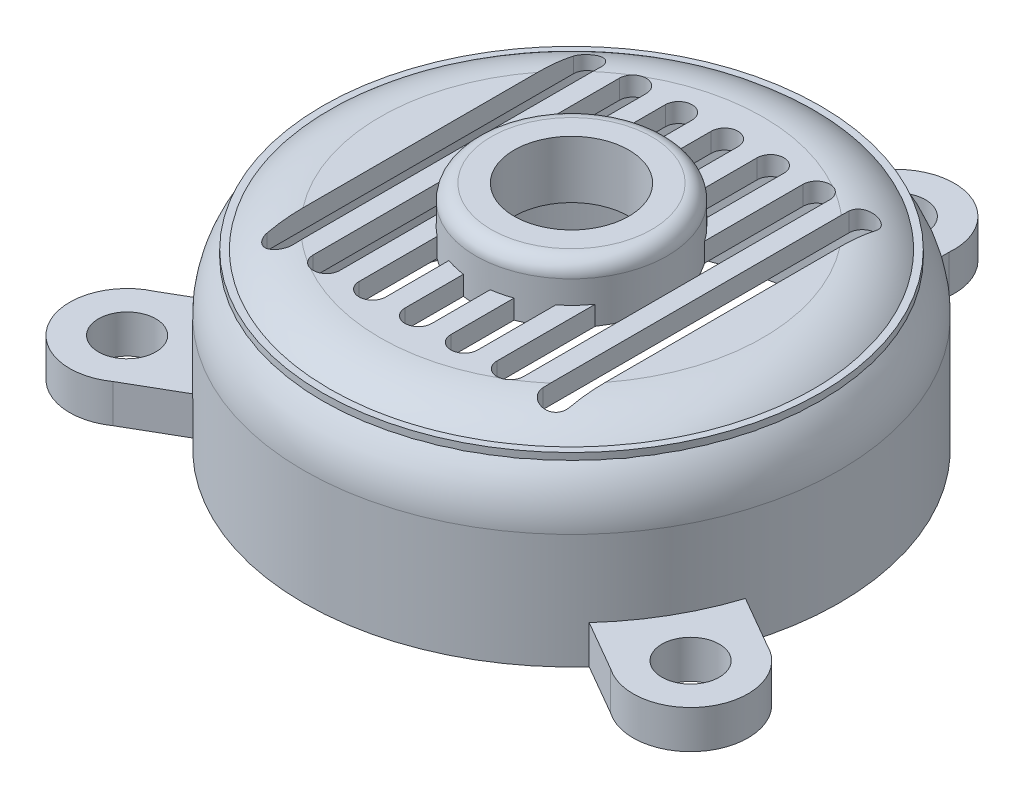
from build123d import *
from build123d.topology import SkipClean

# Parameters (mm, degrees)
SKETCH1_R               = 3.5
BOSS_EXTRUDE1_DEPTH     = 2.5
SHELL1_T                = -0.25
SKETCH1_3_R             = 0.375
BOSS_EXTRUDE2_DEPTH     = 0.5
FILLET2_R               = 1
CUT_EXTRUDE1_DEPTH      = 8.133041914
LPATTERN3_COUNT         = 7
LPATTERN3_PITCH         = 0.6
BOSS_EXTRUDE3_START     = -0.25
SKETCH4_R               = 1.25
SKETCH4_R_2             = 0.75
BOSS_EXTRUDE3_DEPTH     = 0.75
FILLET3_R               = 0.2
CUT_EXTRUDE2_DEPTH      = 8.133041914
CUT_EXTRUDE2_DEPTH_BACK = 8.133041914
SKETCH4_2_R             = 0.75


with BuildPart() as part:
    # Sketch1 → Boss-Extrude1 (new body)
    with BuildSketch(Plane(origin=(0, 0, 0), x_dir=(1, 0, 0), z_dir=(0, 1, 0))):
        with Locations(Location((0, 0, 0), (0, 0, 270))):
            Circle(SKETCH1_R)
    extrude(amount=BOSS_EXTRUDE1_DEPTH)

    # Shell1
    shell1_openings = [part.faces().sort_by_distance(p)[0] for p in [
        (0, 0, 0),
    ]]
    offset(amount=SHELL1_T, openings=shell1_openings, kind=Kind.INTERSECTION)

    # Sketch1<3> → Boss-Extrude2 (add)
    # profile 1 of 3: a face of its own
    with BuildSketch(Plane(origin=(0, 0, 0), x_dir=(1, 0, 0), z_dir=(0, 1, 0))):
        with BuildLine():
            Line((3.996834834, -1.444926057), (3.334771827, -1.062683802))
            ThreePointArc((3.334771827, -1.062683802), (3.031088913, -1.75), (2.587697082, -2.356655217))
            Line((2.587697082, -2.356655217), (3.249760089, -2.738897472))
            ThreePointArc((3.249760089, -2.738897472), (4.330127019, -2.5), (3.996834834, -1.444926057))
        make_face()
        with Locations(Location((3.680607966, -2.125, 0), (0, 0, 270))):
            Circle(SKETCH1_3_R, mode=Mode.SUBTRACT)
    # profile 2 of 3: a face of its own
    with BuildSketch(Plane(origin=(0, 0, 0), x_dir=(1, 0, 0), z_dir=(0, 1, 0))):
        with BuildLine():
            ThreePointArc((-0.747074745, 3.419339019), (0, 3.5), (0.747074745, 3.419339019))
            Line((0.747074745, 3.419339019), (0.747074745, 4.183823529))
            ThreePointArc((0.747074745, 4.183823529), (0, 5), (-0.747074745, 4.183823529))
            Line((-0.747074745, 4.183823529), (-0.747074745, 3.419339019))
        make_face()
        with Locations(Location((0, 4.25, 0), (0, 0, 270))):
            Circle(SKETCH1_3_R, mode=Mode.SUBTRACT)
    # profile 3 of 3: a face of its own
    with BuildSketch(Plane(origin=(0, 0, 0), x_dir=(1, 0, 0), z_dir=(0, 1, 0))):
        with BuildLine():
            ThreePointArc((-2.587697082, -2.356655217), (-3.031088913, -1.75), (-3.334771827, -1.062683802))
            Line((-3.334771827, -1.062683802), (-3.996834834, -1.444926057))
            ThreePointArc((-3.996834834, -1.444926057), (-4.330127019, -2.5), (-3.249760089, -2.738897472))
            Line((-3.249760089, -2.738897472), (-2.587697082, -2.356655217))
        make_face()
        with Locations(Location((-3.680607966, -2.125, 0), (0, 0, 270))):
            Circle(SKETCH1_3_R, mode=Mode.SUBTRACT)
    extrude(amount=BOSS_EXTRUDE2_DEPTH)

    # Fillet2
    fillet2_edges = [part.edges().sort_by_distance(p)[0] for p in [
        (0, 2.5, -3.5),
    ]]
    fillet(fillet2_edges, radius=FILLET2_R)

    # Sketch3 → Cut-Extrude1 (cut, symmetric)
    with BuildSketch(Plane(origin=(0, 2.5, 0), x_dir=(1, 0, 0), z_dir=(0, 1, 0))):
        with BuildLine():
            Line((1.625, -2), (1.625, 2))
            ThreePointArc((1.625, 2), (1.8, 2.175), (1.975, 2))
            Line((1.975, 2), (1.975, -2))
            ThreePointArc((1.975, -2), (1.8, -2.175), (1.625, -2))
        make_face()
    cut_extrude1 = extrude(amount=CUT_EXTRUDE1_DEPTH, both=True, mode=Mode.SUBTRACT)

    # LPattern3: Cut-Extrude1 ×7
    with Locations(*[(-i * LPATTERN3_PITCH, 0, 0) for i in range(1, LPATTERN3_COUNT)]):
        add(cut_extrude1, mode=Mode.SUBTRACT)

    # Sketch4 → Boss-Extrude3 (add)
    with BuildSketch(Plane(origin=(0, 2.5, 0), x_dir=(1, 0, 0), z_dir=(0, 1, 0)).offset(BOSS_EXTRUDE3_START)):
        with Locations(Location((0, 0, 0), (0, 0, 81.952153753))):
            Circle(SKETCH4_R)
        with Locations(Location((0, 0, 0), (0, 0, 76.506601178))):
            Circle(SKETCH4_R_2, mode=Mode.SUBTRACT)
    extrude(amount=BOSS_EXTRUDE3_DEPTH)

    # Fillet3
    fillet3_edges = [part.edges().sort_by_distance(p)[0] for p in [
        (-0.175, 3, 1.237689379),
    ]]
    fillet(fillet3_edges, radius=FILLET3_R)

    # Sketch4<2> → Cut-Extrude2 (cut, two sides: drawn at the far end of the back side and taken through both)
    with SkipClean():  # the faces are left unmerged after this step: merging them gives an invalid solid
        with BuildSketch(Plane(origin=(0, 2.5, 0), x_dir=(1, 0, 0), z_dir=(0, 1, 0)).offset(-CUT_EXTRUDE2_DEPTH_BACK)):
            with Locations(Location((0, 0, 0), (0, 0, 270))):
                Circle(SKETCH4_2_R)
        extrude(amount=CUT_EXTRUDE2_DEPTH + CUT_EXTRUDE2_DEPTH_BACK, mode=Mode.SUBTRACT)


solid = part.part
